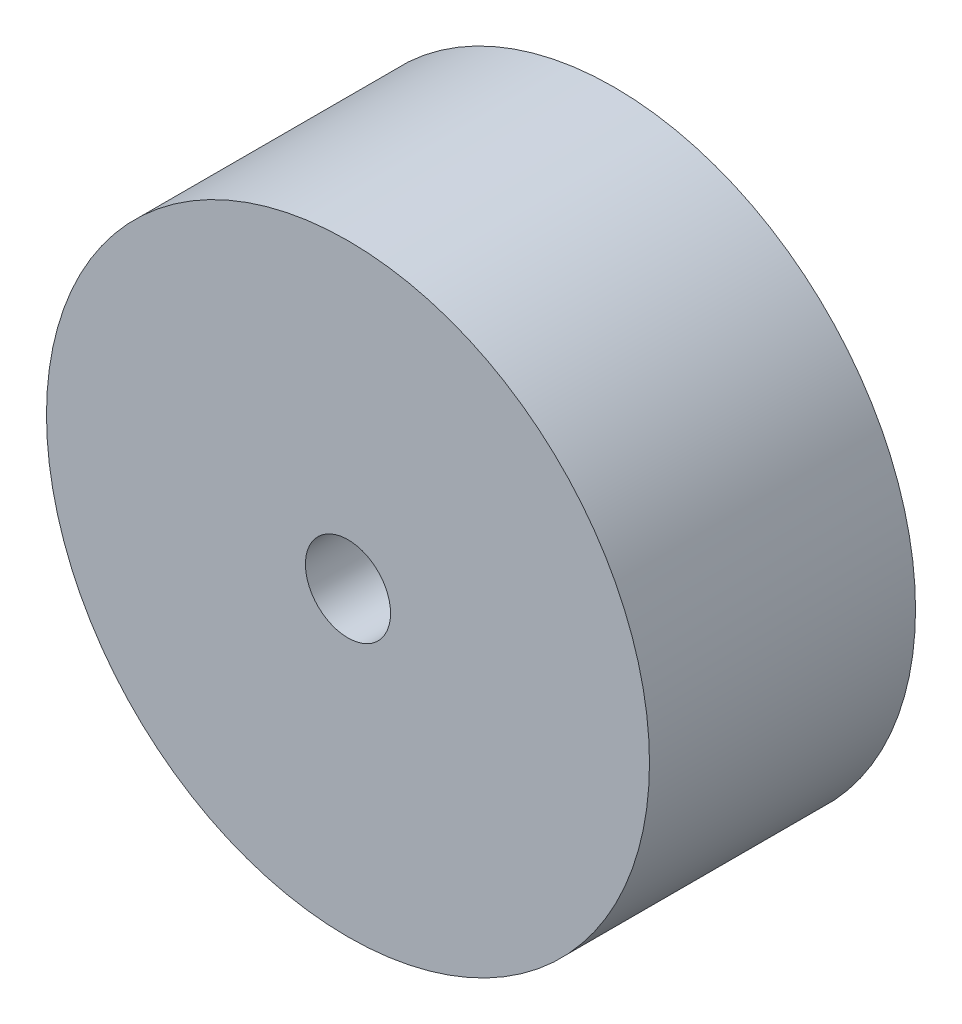
from build123d import *

# Parameters (mm, degrees)
SKETCH1_R           = 21.59
BOSS_EXTRUDE1_DEPTH = 19.05
SKETCH2_R           = 3.048
CUT_EXTRUDE2_DEPTH  = 7.62
SKETCH3_R           = 6.35
CUT_EXTRUDE3_DEPTH  = 7.62


with BuildPart() as part:
    # Sketch1 → Boss-Extrude1 (new body)
    with BuildSketch(Plane.XY):
        with Locations(Location((0, 0, 0), (0, 0, 180))):
            Circle(SKETCH1_R)
    extrude(amount=BOSS_EXTRUDE1_DEPTH)

    # Sketch2 → Cut-Extrude2 (cut)
    with BuildSketch(Plane.XY.offset(19.05)):
        Circle(SKETCH2_R)
    extrude(amount=-CUT_EXTRUDE2_DEPTH, mode=Mode.SUBTRACT)

    # Sketch3 → Cut-Extrude3 (cut)
    with BuildSketch(Plane(origin=(0, 0, 0), x_dir=(-1, 0, 0), z_dir=(0, 0, -1))):
        Circle(SKETCH3_R)
    extrude(amount=-CUT_EXTRUDE3_DEPTH, mode=Mode.SUBTRACT)


solid = part.part
